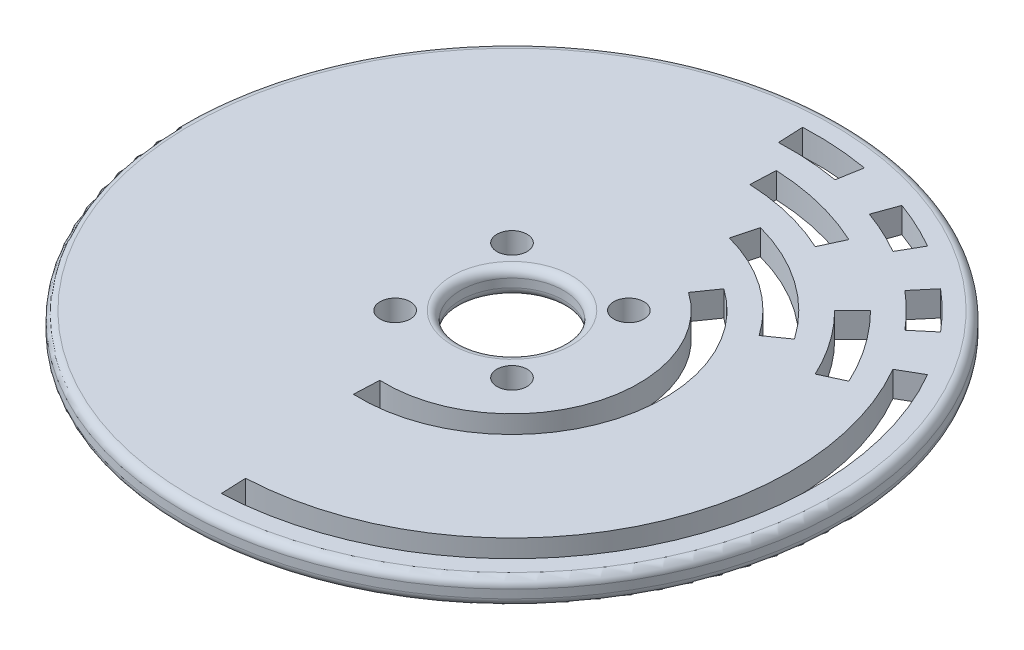
from build123d import *

# Parameters (mm, degrees)
SKETCH4_R           = 39
BOSS_EXTRUDE1_DEPTH = 3
CUT_EXTRUDE1_DEPTH  = 3
SKETCH1_R           = 6.096
SKETCH1_R_2         = 1.7859375
CUT_EXTRUDE3_DEPTH  = 3
FILLET1_R           = 1


with BuildPart() as part:
    # Sketch4 → Boss-Extrude1 (new body)
    with BuildSketch(Plane(origin=(0, 0, 0), x_dir=(1, 0, 0), z_dir=(0, 1, 0))):
        with Locations(Location((0, 0, 0), (0, 0, 270))):
            Circle(SKETCH4_R)
    extrude(amount=BOSS_EXTRUDE1_DEPTH)

    # Sketch3 → Cut-Extrude1 (cut)
    with BuildSketch(Plane(origin=(0, 0, 0), x_dir=(1, 0, 0), z_dir=(0, 1, 0))):
        with BuildLine():
            Line((-0.65429081, -14.985723324), (-0.785148973, -17.982867988))
            ThreePointArc((-0.785148973, -17.982867988), (17.044742331, -5.785910375), (10.324375854, 14.744736797))
            Line((10.324375854, 14.744736797), (8.603646545, 12.287280664))
            ThreePointArc((8.603646545, 12.287280664), (14.203951942, -4.82159198), (-0.65429081, -14.985723324))
        make_face()
        with BuildLine():
            Line((1.439439783, -32.968591312), (1.570297945, -35.965735977))
            ThreePointArc((1.570297945, -35.965735977), (31.562163205, -17.315595681), (31.176914536, 18))
            Line((31.176914536, 18), (28.578838325, 16.5))
            ThreePointArc((28.578838325, 16.5), (28.931982938, -15.872629374), (1.439439783, -32.968591312))
        make_face()
        with BuildLine():
            Line((-1.570297945, 35.965735977), (-1.439439783, 32.968591312))
            ThreePointArc((-1.439439783, 32.968591312), (2.158303265, 32.929344467), (5.730389863, 32.498655849))
            Line((5.730389863, 32.498655849), (6.251334396, 35.453079108))
            ThreePointArc((6.251334396, 35.453079108), (2.354512652, 35.922921237), (-1.570297945, 35.965735977))
        make_face()
        with BuildLine():
            Line((12.31272516, 33.828934348), (11.28666473, 31.009856486))
            ThreePointArc((11.28666473, 31.009856486), (13.946402637, 29.908156972), (16.5, 28.578838325))
            Line((16.5, 28.578838325), (18, 31.176914536))
            ThreePointArc((18, 31.176914536), (15.214257423, 32.627080333), (12.31272516, 33.828934348))
        make_face()
        with BuildLine():
            Line((23.140353949, 27.577599952), (21.21199112, 25.279466623))
            ThreePointArc((21.21199112, 25.279466623), (23.334523779, 23.334523779), (25.279466623, 21.21199112))
            Line((25.279466623, 21.21199112), (27.577599952, 23.140353949))
            ThreePointArc((27.577599952, 23.140353949), (25.455844123, 25.455844123), (23.140353949, 27.577599952))
        make_face()
        with BuildLine():
            Line((1.308581621, 29.971446647), (1.177723459, 26.974301983))
            ThreePointArc((1.177723459, 26.974301983), (6.417519093, 26.226235885), (11.410693067, 24.47031025))
            Line((11.410693067, 24.47031025), (12.678547852, 27.189233611))
            ThreePointArc((12.678547852, 27.189233611), (7.13057677, 29.140262094), (1.308581621, 29.971446647))
        make_face()
        with BuildLine():
            Line((21.21199112, 21.214415682), (19.090792008, 19.092974114))
            ThreePointArc((19.090792008, 19.092974114), (22.116662678, 15.487195744), (24.47031025, 11.410693067))
            Line((24.47031025, 11.410693067), (27.189233611, 12.678547852))
            ThreePointArc((27.189233611, 12.678547852), (24.574069642, 17.207995271), (21.21199112, 21.214415682))
        make_face()
        with BuildLine():
            Line((19.659649063, 13.765834472), (17.20219293, 12.045105163))
            ThreePointArc((17.20219293, 12.045105163), (12.045105163, 17.20219293), (5.435199947, 20.284442352))
            Line((5.435199947, 20.284442352), (6.211657082, 23.182219831))
            ThreePointArc((6.211657082, 23.182219831), (13.765834472, 19.659649063), (19.659649063, 13.765834472))
        make_face()
    extrude(amount=CUT_EXTRUDE1_DEPTH, mode=Mode.SUBTRACT)

    # Sketch1 → Cut-Extrude3 (cut)
    with BuildSketch(Plane(origin=(0, 0, 0), x_dir=(1, 0, 0), z_dir=(0, 1, 0))):
        with Locations(Location((0, 0, 0), (0, 0, 270))):
            Circle(SKETCH1_R)
        with Locations(Location((6.914797213, 6.914797213, 0), (0, 0, 270))):
            Circle(SKETCH1_R_2)
        with Locations(Location((6.914797213, -6.914797213, 0), (0, 0, 270))):
            Circle(SKETCH1_R_2)
        with Locations(Location((-6.914797213, -6.914797213, 0), (0, 0, 270))):
            Circle(SKETCH1_R_2)
        with Locations(Location((-6.914797213, 6.914797213, 0), (0, 0, 270))):
            Circle(SKETCH1_R_2)
    extrude(amount=CUT_EXTRUDE3_DEPTH, mode=Mode.SUBTRACT)

    # Fillet1
    fillet1_edges = [part.edges().sort_by_distance(p)[0] for p in [
        (0, 0, -6.096),
        (0, 3, -6.096),
        (0, 0, -39),
        (0, 3, -39),
    ]]
    fillet(fillet1_edges, radius=FILLET1_R)


solid = part.part
